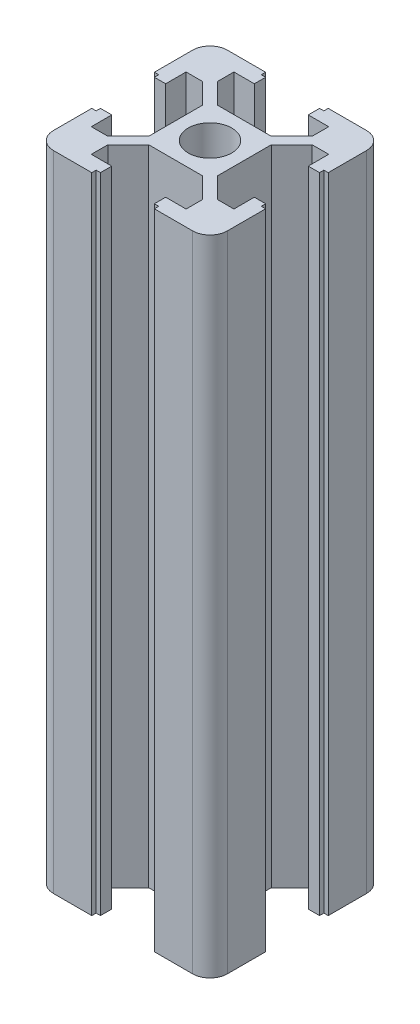
from build123d import *

# Parameters (mm, degrees)
SKETCH_1_R      = 2.5
EXTRUDE_1_DEPTH = 74


with BuildPart() as part:
    # 草图1 → 凸台-拉伸1 (new body)
    with BuildSketch(Plane(origin=(0, 0, 0), x_dir=(1, 0, 0), z_dir=(0, 1, 0))):
        with BuildLine():
            Line((-3.948528137, -3.1), (-6.298528137, -5.45))
            Line((-6.298528137, -5.45), (-8.2, -5.45))
            Line((-8.2, -5.45), (-8.2, -3.1))
            Line((-8.2, -3.1), (-9.5, -3.1))
            Line((-9.5, -3.1), (-9.5, -3.6))
            Line((-9.5, -3.6), (-10, -3.6))
            Line((-10, -3.6), (-10, -8))
            ThreePointArc((-10, -8), (-9.414213562, -9.414213562), (-8, -10))
            Line((-8, -10), (-3.6, -10))
            Line((-3.6, -10), (-3.6, -9.5))
            Line((-3.6, -9.5), (-3.1, -9.5))
            Line((-3.1, -9.5), (-3.1, -8.2))
            Line((-3.1, -8.2), (-5.45, -8.2))
            Line((-5.45, -8.2), (-5.45, -6.298528137))
            Line((-5.45, -6.298528137), (-3.1, -3.948528137))
            Line((-3.1, -3.948528137), (0, -3.948528137))
            Line((0, -3.948528137), (3.1, -3.948528137))
            Line((3.1, -3.948528137), (5.45, -6.298528137))
            Line((5.45, -6.298528137), (5.45, -8.2))
            Line((5.45, -8.2), (3.1, -8.2))
            Line((3.1, -8.2), (3.1, -9.5))
            Line((3.1, -9.5), (3.6, -9.5))
            Line((3.6, -9.5), (3.6, -10))
            Line((3.6, -10), (8, -10))
            ThreePointArc((8, -10), (9.414213562, -9.414213562), (10, -8))
            Line((10, -8), (10, -3.6))
            Line((10, -3.6), (9.5, -3.6))
            Line((9.5, -3.6), (9.5, -3.1))
            Line((9.5, -3.1), (8.2, -3.1))
            Line((8.2, -3.1), (8.2, -5.45))
            Line((8.2, -5.45), (6.298528137, -5.45))
            Line((6.298528137, -5.45), (3.948528137, -3.1))
            Line((3.948528137, -3.1), (3.948528137, 0))
            Line((3.948528137, 0), (3.948528137, 3.1))
            Line((3.948528137, 3.1), (6.298528137, 5.45))
            Line((6.298528137, 5.45), (8.2, 5.45))
            Line((8.2, 5.45), (8.2, 3.1))
            Line((8.2, 3.1), (9.5, 3.1))
            Line((9.5, 3.1), (9.5, 3.6))
            Line((9.5, 3.6), (10, 3.6))
            Line((10, 3.6), (10, 8))
            ThreePointArc((10, 8), (9.414213562, 9.414213562), (8, 10))
            Line((8, 10), (3.6, 10))
            Line((3.6, 10), (3.6, 9.5))
            Line((3.6, 9.5), (3.1, 9.5))
            Line((3.1, 9.5), (3.1, 8.2))
            Line((3.1, 8.2), (5.45, 8.2))
            Line((5.45, 8.2), (5.45, 6.298528137))
            Line((5.45, 6.298528137), (3.1, 3.948528137))
            Line((3.1, 3.948528137), (0, 3.948528137))
            Line((0, 3.948528137), (-3.1, 3.948528137))
            Line((-3.1, 3.948528137), (-5.45, 6.298528137))
            Line((-5.45, 6.298528137), (-5.45, 8.2))
            Line((-5.45, 8.2), (-3.1, 8.2))
            Line((-3.1, 8.2), (-3.1, 9.5))
            Line((-3.1, 9.5), (-3.6, 9.5))
            Line((-3.6, 9.5), (-3.6, 10))
            Line((-3.6, 10), (-8, 10))
            ThreePointArc((-8, 10), (-9.414213562, 9.414213562), (-10, 8))
            Line((-10, 8), (-10, 3.6))
            Line((-10, 3.6), (-9.5, 3.6))
            Line((-9.5, 3.6), (-9.5, 3.1))
            Line((-9.5, 3.1), (-8.2, 3.1))
            Line((-8.2, 3.1), (-8.2, 5.45))
            Line((-8.2, 5.45), (-6.298528137, 5.45))
            Line((-6.298528137, 5.45), (-3.948528137, 3.1))
            Line((-3.948528137, 3.1), (-3.948528137, 0))
            Line((-3.948528137, 0), (-3.948528137, -3.1))
        make_face()
        with Locations(Location((0, 0, 0), (0, 0, 270))):
            Circle(SKETCH_1_R, mode=Mode.SUBTRACT)
    extrude(amount=EXTRUDE_1_DEPTH)


solid = part.part
